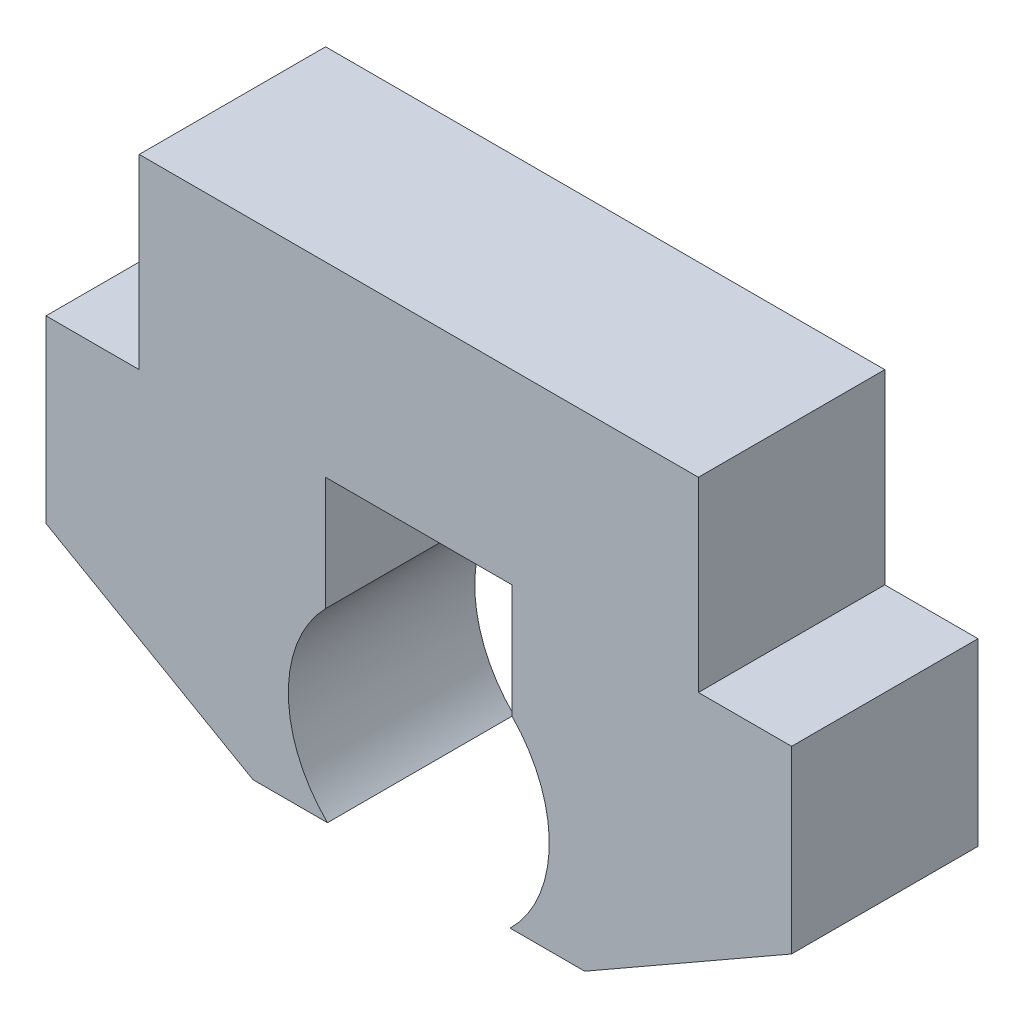
from build123d import *

# Parameters (mm, degrees)
BOSS_EXTRUDE1_DEPTH = 5


with BuildPart() as part:
    # Sketch1 → Boss-Extrude1 (new body)
    with BuildSketch(Plane.XY):
        with BuildLine():
            Line((5.550510257, 0.824633862), (7.550510257, 0.824633862))
            ThreePointArc((7.550510257, 0.824633862), (6.500182239, 3.288917717), (7.5, 5.774123605))
            Line((7.5, 5.774123605), (7.5, 8.824633862))
            Line((7.5, 8.824633862), (12.5, 8.824633862))
            Line((12.5, 8.824633862), (12.5, 5.774123605))
            ThreePointArc((12.5, 5.774123605), (13.499817761, 3.288917717), (12.449489743, 0.824633862))
            Line((12.449489743, 0.824633862), (14.449489743, 0.824633862))
            Line((14.449489743, 0.824633862), (20, 4))
            Line((20, 4), (20, 8.824633862))
            Line((20, 8.824633862), (17.5, 8.824633862))
            Line((17.5, 8.824633862), (17.5, 13.824633862))
            Line((17.5, 13.824633862), (10, 13.824633862))
            Line((10, 13.824633862), (2.5, 13.824633862))
            Line((2.5, 13.824633862), (2.5, 8.824633862))
            Line((2.5, 8.824633862), (0, 8.824633862))
            Line((0, 8.824633862), (0, 4))
            Line((0, 4), (5.550510257, 0.824633862))
        make_face()
    extrude(amount=BOSS_EXTRUDE1_DEPTH)


solid = part.part
